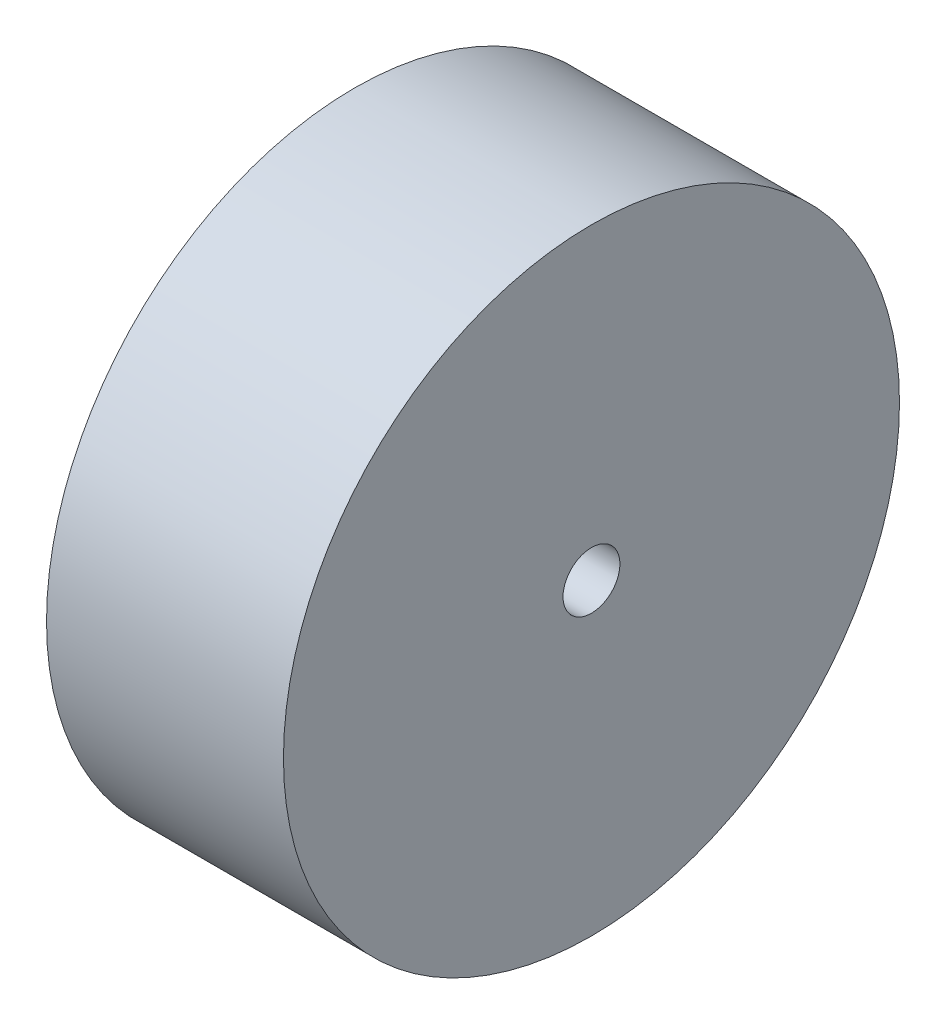
from build123d import *

# Parameters (mm, degrees)
SKETCH1_R           = 32.5
BOSS_EXTRUDE1_DEPTH = 25
SKETCH2_R           = 3
CUT_EXTRUDE1_DEPTH  = 53.321123841


with BuildPart() as part:
    # Sketch1 → Boss-Extrude1 (new body)
    with BuildSketch(Plane(origin=(0, 0, 0), x_dir=(0, 0, -1), z_dir=(1, 0, 0))):
        Circle(SKETCH1_R)
    extrude(amount=BOSS_EXTRUDE1_DEPTH)

    # Sketch2 → Cut-Extrude1 (cut, through all)
    with BuildSketch(Plane.ZY):
        Circle(SKETCH2_R)
    extrude(amount=-CUT_EXTRUDE1_DEPTH, mode=Mode.SUBTRACT)


solid = part.part
